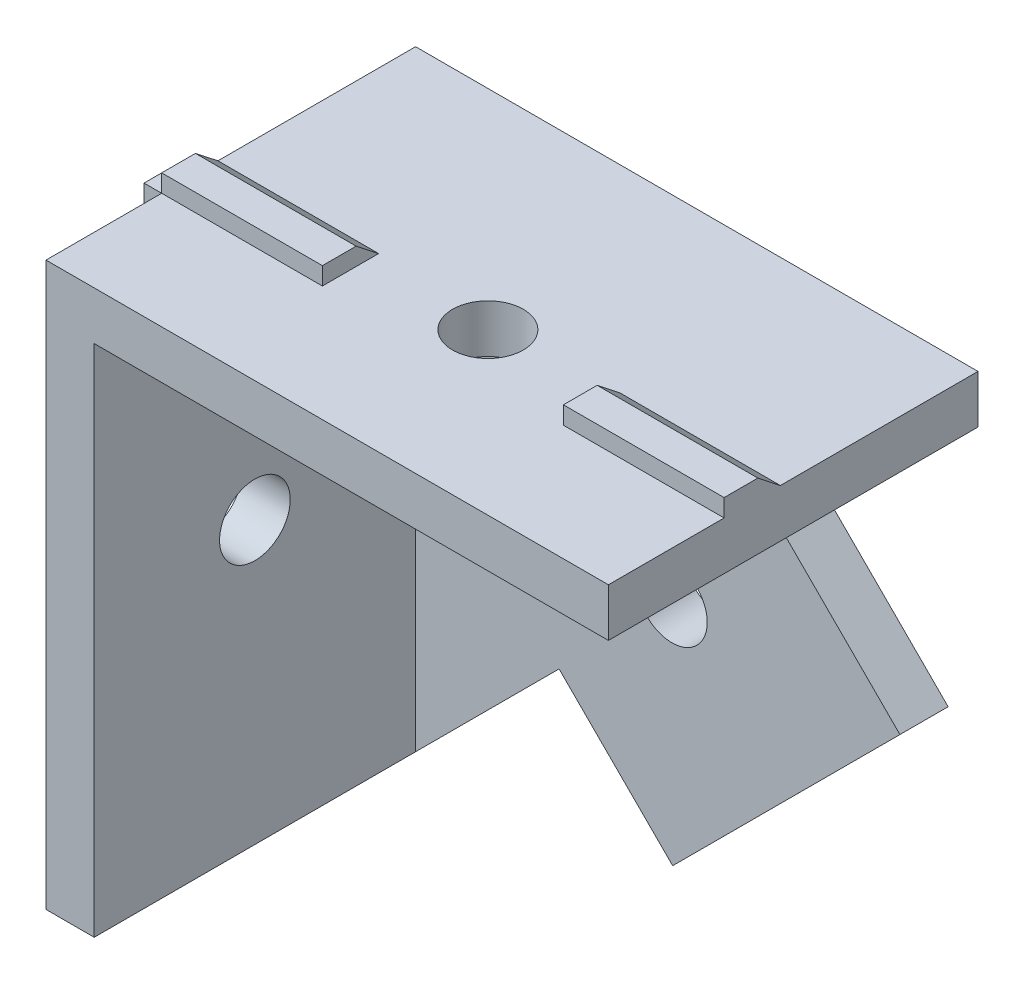
from build123d import *

# Parameters (mm, degrees)
BOSS_EXTRUDE1_DEPTH = 3
BOSS_EXTRUDE2_DEPTH = 20
SKETCH4_R           = 2.2
CUT_EXTRUDE1_DEPTH  = 53.706735812
SKETCH5_R           = 2.2
CUT_EXTRUDE2_DEPTH  = 53.706735812
BOSS_EXTRUDE5_DEPTH = 35
SKETCH7_W           = 15
SKETCH7_H           = 1.1
CUT_EXTRUDE3_DEPTH  = 52.95806001
BOSS_EXTRUDE6_REACH = 57.292
SKETCH9_W           = 1.1
SKETCH9_H           = 15
CUT_EXTRUDE4_DEPTH  = 52.95806001
BOSS_EXTRUDE7_DEPTH = 3
SKETCH11_R          = 2.199996526
CUT_EXTRUDE5_DEPTH  = 54.38539126


with BuildPart() as part:
    # Sketch1 → Boss-Extrude1 (new body)
    with BuildSketch(Plane.XY):
        Polygon((0, -35), (0, 0), (35, 0), (35, -3), (3, -35), align=None)
    extrude(amount=BOSS_EXTRUDE1_DEPTH)

    # Sketch2 → Boss-Extrude2 (add)
    with BuildSketch(Plane.XY.offset(3)):
        Polygon((0, -35), (0, 0), (35, 0), (35, -3), (3, -3), (3, -35), align=None)
    extrude(amount=BOSS_EXTRUDE2_DEPTH)

    # Sketch4 → Cut-Extrude1 (cut, through all)
    with BuildSketch(Plane.XZ.offset(3)):
        with Locations(Location((17.5, 13, 0), (0, 0, 270))):
            Circle(SKETCH4_R)
    extrude(amount=-CUT_EXTRUDE1_DEPTH, mode=Mode.SUBTRACT)

    # Sketch5 → Cut-Extrude2 (cut, through all)
    with BuildSketch(Plane(origin=(3, 0, 0), x_dir=(0, 0, -1), z_dir=(1, 0, 0))):
        with Locations((-13, -17.5)):
            Circle(SKETCH5_R)
    extrude(amount=-CUT_EXTRUDE2_DEPTH, mode=Mode.SUBTRACT)

    # Sketch6 → Boss-Extrude5 (add, through all)
    with BuildSketch(Plane(origin=(35, 0, 0), x_dir=(0, 0, -1), z_dir=(1, 0, 0))):
        Polygon((-15.8, 0), (-15.8, 1.1), (-13.7, 1.1), (-12.3, 0), align=None)
    extrude(amount=-BOSS_EXTRUDE5_DEPTH)

    # Sketch7 → Cut-Extrude3 (cut, through all)
    with BuildSketch(Plane.XY.offset(15.8)):
        with Locations((17.5, 0.55)):
            Rectangle(SKETCH7_W, SKETCH7_H)
    extrude(amount=-CUT_EXTRUDE3_DEPTH, mode=Mode.SUBTRACT)

    # Boss-Extrude6: up to this face of the body (flat: up to its plane)
    boss_extrude6_end = Plane(part.part.faces().sort_by_distance((0.418807832, 0, 19.4))[0])
    # Sketch8 → Boss-Extrude6 (add, up to the picked face)
    with BuildSketch(Plane.XZ.offset(35), mode=Mode.PRIVATE) as boss_extrude6_sk1:
        Polygon((0, 12.3), (0, 15.8), (-1.1, 15.8), (-1.1, 13.7), align=None)
    boss_extrude6_tool1 = split(extrude(boss_extrude6_sk1.sketch, amount=-BOSS_EXTRUDE6_REACH, mode=Mode.PRIVATE), bisect_by=boss_extrude6_end, keep=Keep.BOTH, mode=Mode.PRIVATE)
    add(boss_extrude6_tool1.solids().sort_by(Axis((-0.504167, -35, 14.370833), (0, 1, 0)))[0])

    # Sketch9 → Cut-Extrude4 (cut, through all)
    with BuildSketch(Plane.XY.offset(15.8)):
        with Locations((-0.55, -17.5)):
            Rectangle(SKETCH9_W, SKETCH9_H)
    extrude(amount=-CUT_EXTRUDE4_DEPTH, mode=Mode.SUBTRACT)

    # Sketch10 → Boss-Extrude7 (add)
    with BuildSketch(Plane.XY.offset(3)):
        Polygon((11.92856235, -26.07143765), (26.070567589, -11.929432411), (33.142000437, -19.001990557), (18.998870149, -33.142870566), align=None)
    extrude(amount=-BOSS_EXTRUDE7_DEPTH)

    # Sketch11 → Cut-Extrude5 (cut, through all)
    with BuildSketch(Plane.XY.offset(3)):
        with Locations((18.950998351, -18.951996964)):
            Circle(SKETCH11_R)
    extrude(amount=-CUT_EXTRUDE5_DEPTH, mode=Mode.SUBTRACT)


solid = part.part
